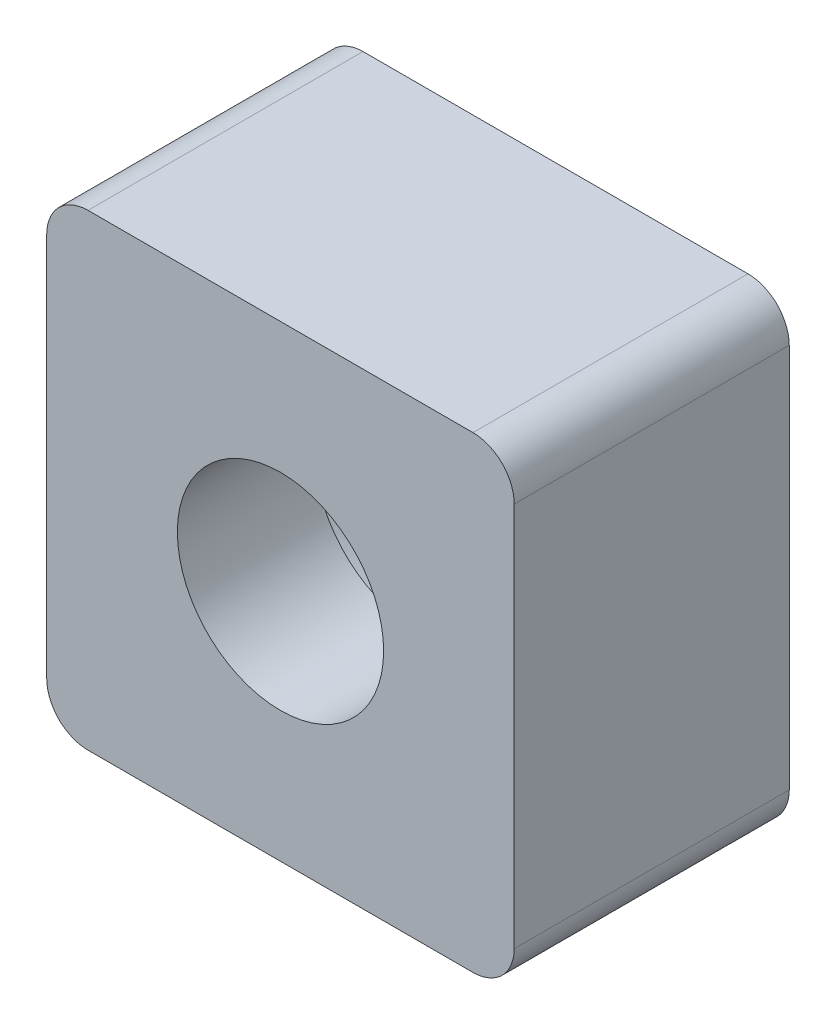
from build123d import *

# Parameters (mm, degrees)
BOSS_EXTRUDE1_DEPTH = 4
SKETCH2_R           = 1.5
CUT_EXTRUDE1_DEPTH  = 4
SKETCH3_R           = 3
CUT_EXTRUDE2_DEPTH  = 2


with BuildPart() as part:
    # Sketch1 → Boss-Extrude1 (new body)
    with BuildSketch(Plane.XY):
        with BuildLine():
            Line((-3.399881961, 2.8), (-3.399881961, -2.8))
            add(Edge.make_bspline(
                [(-3.399881961, -2.8), (-3.399881961, -2.953071187), (-3.271882834, -3.271984466), (-2.952966029, -3.4), (-2.799893385, -3.4)],
                knots=[-1.570796327, -1.570796327, -1.570796327, -1.570796327, -0.785398163, 0, 0, 0, 0], degree=3))
            Line((-2.799893385, -3.4), (2.799893385, -3.4))
            add(Edge.make_bspline(
                [(2.799893385, -3.4), (2.952966029, -3.4), (3.271882834, -3.271984466), (3.399881961, -2.953071187), (3.399881961, -2.8)],
                knots=[0, 0, 0, 0, 0.785398163, 1.570796327, 1.570796327, 1.570796327, 1.570796327], degree=3))
            Line((3.399881961, -2.8), (3.399881961, 2.8))
            add(Edge.make_bspline(
                [(3.399881961, 2.8), (3.399881961, 2.953071187), (3.271882834, 3.271984466), (2.952966029, 3.4), (2.799893385, 3.4)],
                knots=[1.570796327, 1.570796327, 1.570796327, 1.570796327, 2.35619449, 3.141592654, 3.141592654, 3.141592654, 3.141592654], degree=3))
            Line((2.799893385, 3.4), (-2.799893385, 3.4))
            add(Edge.make_bspline(
                [(-2.799893385, 3.4), (-2.952966029, 3.4), (-3.271882834, 3.271984466), (-3.399881961, 2.953071187), (-3.399881961, 2.8)],
                knots=[-3.141592654, -3.141592654, -3.141592654, -3.141592654, -2.35619449, -1.570796327, -1.570796327, -1.570796327, -1.570796327], degree=3))
        make_face()
    extrude(amount=BOSS_EXTRUDE1_DEPTH)

    # Sketch2 → Cut-Extrude1 (cut)
    with BuildSketch(Plane.XY.offset(4)):
        Circle(SKETCH2_R)
    extrude(amount=-CUT_EXTRUDE1_DEPTH, mode=Mode.SUBTRACT)

    # Sketch3 → Cut-Extrude2 (cut)
    with BuildSketch(Plane(origin=(0, 0, 0), x_dir=(-1, 0, 0), z_dir=(0, 0, -1))):
        Circle(SKETCH3_R)
    extrude(amount=-CUT_EXTRUDE2_DEPTH, mode=Mode.SUBTRACT)


solid = part.part
